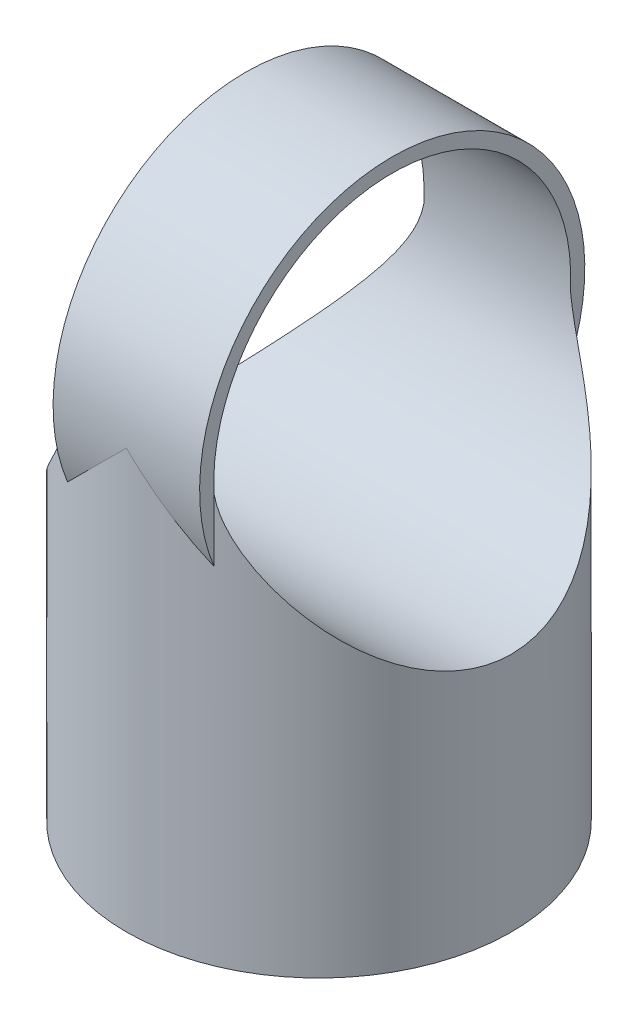
from build123d import *

# Parameters (mm, degrees)
SKETCH1_R               = 116.84
SKETCH1_R_2             = 107.95
BOSS_EXTRUDE1_DEPTH     = 44.45
CUT_EXTRUDE6_DEPTH      = 288.798
CUT_EXTRUDE6_DEPTH_BACK = 154.94
SKETCH14_R              = 108.247485137
SKETCH15_R              = 76.2
CUT_EXTRUDE7_DEPTH      = 63.5


with BuildPart() as part:
    # Sketch1 → Boss-Extrude1 (new, symmetric)
    with BuildSketch(Plane(origin=(0, 0, 0), x_dir=(0, 0, -1), z_dir=(1, 0, 0))):
        Circle(SKETCH1_R)
        Circle(SKETCH1_R_2, mode=Mode.SUBTRACT)
    extrude(amount=BOSS_EXTRUDE1_DEPTH, both=True)

    # Sketch13 → Revolve3 (revolve)
    with BuildSketch(Plane(origin=(0, 0, 0), x_dir=(0, 0, -1), z_dir=(1, 0, 0))):
        with BuildLine():
            Line((-116.84, 0), (-116.84, -254.257018714))
            Line((-116.84, -254.257018714), (0, -254.257018714))
            Line((0, -254.257018714), (0, -116.84))
            ThreePointArc((0, -116.84), (-82.618356314, -82.618356314), (-116.84, 0))
        make_face()
    revolve(axis=Axis((0, -116.84, 0), (0, -1, 0)))

    # Sketch14 → Cut-Extrude6 (cut, two sides: drawn at the far end of the back side and taken through both)
    with BuildSketch(Plane(origin=(0, 0, 0), x_dir=(0, 0, -1), z_dir=(1, 0, 0)).offset(-CUT_EXTRUDE6_DEPTH_BACK)):
        with Locations(Location((0, 0, 0), (0, 0, 356.57852909))):
            Circle(SKETCH14_R)
    extrude(amount=CUT_EXTRUDE6_DEPTH + CUT_EXTRUDE6_DEPTH_BACK, mode=Mode.SUBTRACT)

    # Sketch15 → Cut-Extrude7 (cut)
    with BuildSketch(Plane.XZ.offset(254.257018714)):
        with Locations(Location((0, 0, 0), (0, 0, 270))):
            Circle(SKETCH15_R)
    extrude(amount=-CUT_EXTRUDE7_DEPTH, mode=Mode.SUBTRACT)


solid = part.part
